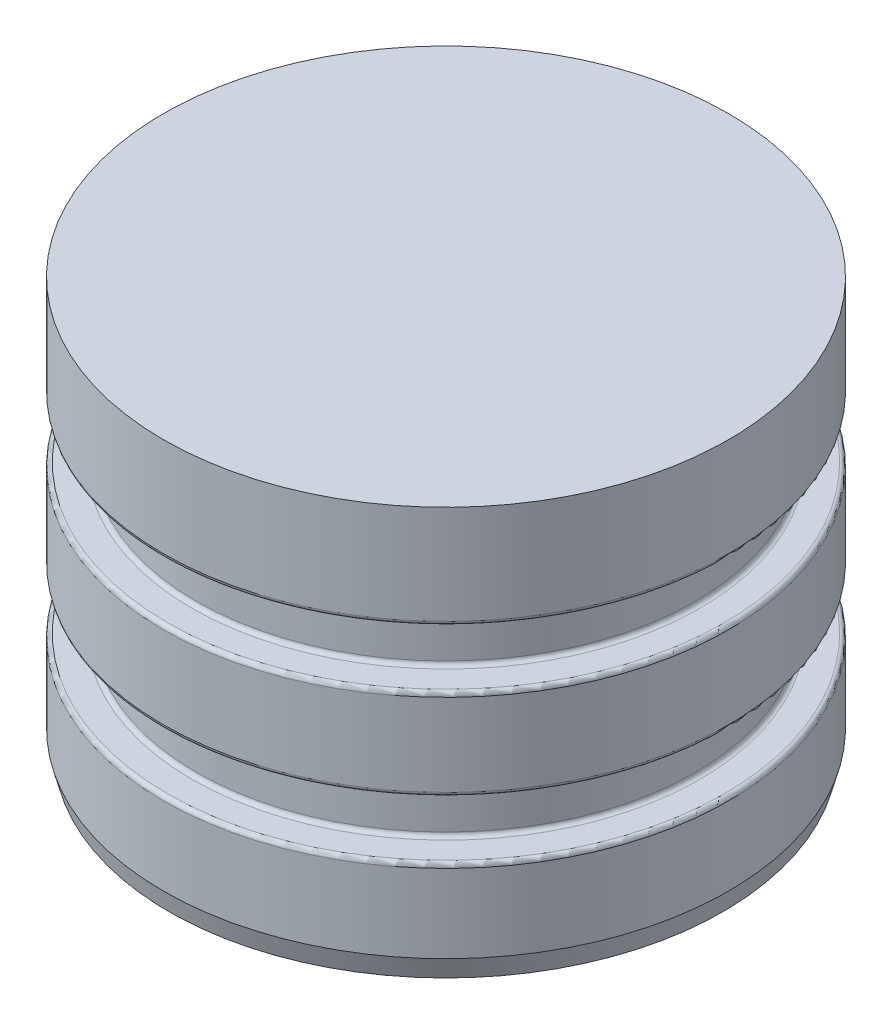
from build123d import *

# Parameters (mm, degrees)
SKETCH3_R          = 8.763
CUT_EXTRUDE1_DEPTH = 22.098
FILLET3_R          = 0.254
CHAMFER1_SIZE      = 1.27
CHAMFER1_SIZE2     = 0.340295474


with BuildPart() as part:
    # Sketch2 → Revolve1 (revolve)
    with BuildSketch(Plane.XY, mode=Mode.PRIVATE) as revolve1_sk:
        Polygon((0, 25.4), (-17.4371, 25.4), (-17.4371, 19.05), (-15.4051, 19.05), (-15.4051, 15.494), (-17.4371, 15.494), (-17.4371, 9.906), (-15.4051, 9.906), (-15.4051, 6.35), (-17.4371, 6.35), (-17.4371, 0), (0, 0), align=None)
    revolve(revolve1_sk.sketch.rotate(Axis((0, 0, 0), (0, -1, 0)), 270), axis=Axis((0, 0, 0), (0, -1, 0)))

    # Sketch3 → Cut-Extrude1 (cut)
    with BuildSketch(Plane.XZ):
        with Locations(Location((0, 0, 0), (0, 0, 270))):
            Circle(SKETCH3_R)
    extrude(amount=-CUT_EXTRUDE1_DEPTH, mode=Mode.SUBTRACT)

    # Fillet3
    fillet3_edges = [part.edges().sort_by_distance(p)[0] for p in [
        (0, 9.906, -15.4051),
        (0, 9.906, -17.4371),
        (0, 15.494, -17.4371),
        (0, 15.494, -15.4051),
        (0, 19.05, -15.4051),
        (0, 19.05, -17.4371),
        (0, 6.35, -17.4371),
        (0, 6.35, -15.4051),
    ]]
    fillet(fillet3_edges, radius=FILLET3_R)

    # Chamfer1
    chamfer1_edges = [part.edges().sort_by_distance(p)[0] for p in [
        (0, 0, -17.4371),
    ]]
    chamfer1_side = [part.faces().sort_by_distance(p)[0] for p in [
        (0, 3.048, -17.4371),
    ]]
    chamfer(chamfer1_edges, length=CHAMFER1_SIZE, length2=CHAMFER1_SIZE2, reference=chamfer1_side[0])


solid = part.part
